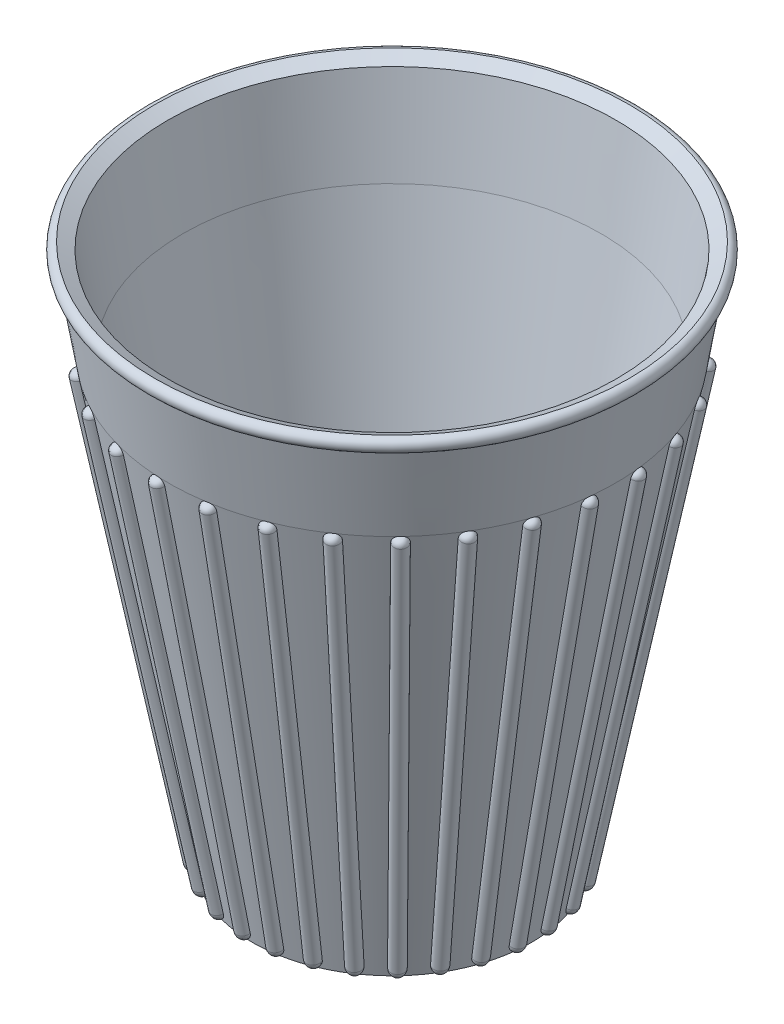
from build123d import *

# Parameters (mm, degrees)
CIRPATTERN1_COUNT = 29


with BuildPart() as part:
    # Sketch1 → Revolve1 (revolve)
    with BuildSketch(Plane.XY):
        with BuildLine():
            Line((-32.130708731, -1), (-34, 0))
            ThreePointArc((-34, 0), (-35, -1), (-34, -2))
            Line((-34, -2), (-32, -14))
            Line((-32, -14), (-20, -77))
            Line((-20, -77), (-12.6, -77))
            Line((-12.6, -77), (-12.322608601, -76.778086881))
            ThreePointArc((-12.322608601, -76.778086881), (-12.290715274, -76.666899306), (-12.385078106, -76.6))
            Line((-12.385078106, -76.6), (-12.6, -76.6))
            Line((-12.6, -76.6), (-12.6, -75.2))
            Line((-12.6, -75.2), (0, -75.2))
            Line((0, -75.2), (0, -74))
            Line((0, -74), (-18.535470636, -74))
            Line((-18.535470636, -74), (-29.964042064, -14))
            Line((-29.964042064, -14), (-32.130708731, -1))
        make_face()
    revolve(axis=Axis((0, 0, 0), (0, -1, 0)))

    # Sketch2 → Revolve7 (revolve)
    with BuildSketch(Plane.XY):
        with BuildLine():
            Line((-32, -14), (-20, -77))
            ThreePointArc((-20, -77), (-20.784277354, -76.717582079), (-21.208455158, -76))
            Line((-21.208455158, -76), (-32.827502777, -15))
            ThreePointArc((-32.827502777, -15), (-32.648991688, -14.305337999), (-32, -14))
        make_face()
    revolve7 = revolve(axis=Axis((-32.971330552, -8.900514604, 0), (0.18711210788999555, -0.9823385664224746, 0)))

    # CirPattern1: Revolve7 ×29 about axis
    cirpattern1_axis = Axis((0, -14, 0), (0, 1, 0))
    for i in range(1, CIRPATTERN1_COUNT):
        add(revolve7.rotate(cirpattern1_axis, i * 360 / CIRPATTERN1_COUNT))


solid = part.part
